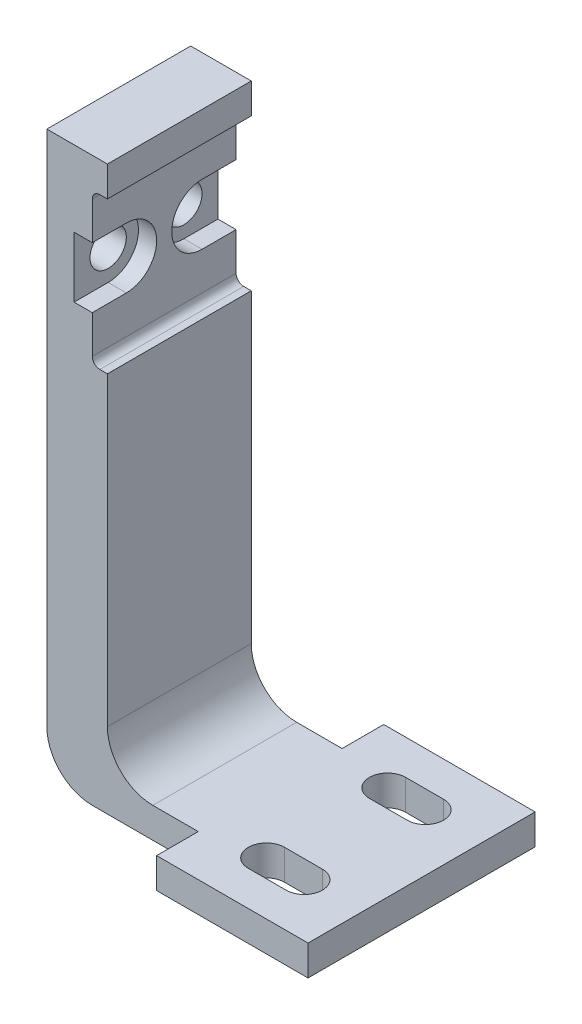
from build123d import *

# Parameters (mm, degrees)
BOSS_EXTRUDE1_DEPTH  = 4.75
M2_CLEARANCE_HOLE1_D = 2.4
CUT_EXTRUDE1_DEPTH   = 1.2
SKETCH5_W            = 10
SKETCH5_H            = 15
BOSS_EXTRUDE2_DEPTH  = 2
CUT_EXTRUDE2_DEPTH   = 2
FILLET1_R            = 3
FILLET2_R            = 0.5


with BuildPart() as part:
    # Sketch1 → Boss-Extrude1 (new, symmetric)
    with BuildSketch(Plane.XY):
        Polygon((-16.53737418, 17.07), (-16.53737418, 27.07), (-15.53737418, 27.07), (-15.53737418, 29.07), (-19.53737418, 29.07), (-19.53737418, 0), (-19.53737418, -8.11), (-11.42737418, -8.11), (0.46262582, -8.11), (0.46262582, -6.11), (-15.42737418, -6.11), (-15.53737418, -6.11), (-15.53737418, 14.07), (-15.53737418, 17.07), align=None)
    extrude(amount=BOSS_EXTRUDE1_DEPTH, both=True)

    # M2 Clearance Hole1 (through all)
    with Locations(Plane(origin=(-16.53737418, 22.07, 2.5), x_dir=(0, 1, 0), z_dir=(1, 0, 0))):
        with Locations((0, 0), (0, -5)):
            Hole(M2_CLEARANCE_HOLE1_D / 2)

    # Sketch4 → Cut-Extrude1 (cut)
    with BuildSketch(Plane(origin=(-16.53737418, 0, 0), x_dir=(0, 0, -1), z_dir=(1, 0, 0))):
        with BuildLine():
            Line((-2.5, 24.07), (-4.75, 24.07))
            Line((-4.75, 24.07), (-4.75, 20.07))
            Line((-4.75, 20.07), (-2.5, 20.07))
            ThreePointArc((-2.5, 20.07), (-0.5, 22.07), (-2.5, 24.07))
        make_face()
        with BuildLine():
            Line((4.75, 20.07), (2.5, 20.07))
            ThreePointArc((2.5, 20.07), (0.5, 22.07), (2.5, 24.07))
            Line((2.5, 24.07), (4.75, 24.07))
            Line((4.75, 24.07), (4.75, 20.07))
        make_face()
    extrude(amount=-CUT_EXTRUDE1_DEPTH, mode=Mode.SUBTRACT)

    # Sketch5 → Boss-Extrude2 (add)
    with BuildSketch(Plane.XZ.offset(8.11)):
        with Locations((-4.53737418, 0)):
            Rectangle(SKETCH5_W, SKETCH5_H)
    extrude(amount=-BOSS_EXTRUDE2_DEPTH)

    # Sketch6 → Cut-Extrude2 (cut)
    with BuildSketch(Plane(origin=(0, -6.11, 0), x_dir=(1, 0, 0), z_dir=(0, 1, 0))):
        with BuildLine():
            Line((-3.28737418, -5.2), (-5.78737418, -5.2))
            ThreePointArc((-5.78737418, -5.2), (-6.98737418, -4), (-5.78737418, -2.8))
            Line((-5.78737418, -2.8), (-3.28737418, -2.8))
            ThreePointArc((-3.28737418, -2.8), (-2.08737418, -4), (-3.28737418, -5.2))
        make_face()
        with BuildLine():
            Line((-3.28737418, 5.2), (-5.78737418, 5.2))
            ThreePointArc((-5.78737418, 5.2), (-6.98737418, 4), (-5.78737418, 2.8))
            Line((-5.78737418, 2.8), (-3.28737418, 2.8))
            ThreePointArc((-3.28737418, 2.8), (-2.08737418, 4), (-3.28737418, 5.2))
        make_face()
    extrude(amount=-CUT_EXTRUDE2_DEPTH, mode=Mode.SUBTRACT)

    # Fillet1
    fillet1_edges = [part.edges().sort_by_distance(p)[0] for p in [
        (-15.53737418, -6.11, 0),
        (-19.53737418, -8.11, 0),
    ]]
    fillet(fillet1_edges, radius=FILLET1_R)

    # Fillet2
    fillet2_edges = [part.edges().sort_by_distance(p)[0] for p in [
        (-16.53737418, 27.07, 0),
        (-16.53737418, 17.07, 0),
    ]]
    fillet(fillet2_edges, radius=FILLET2_R)


solid = part.part
